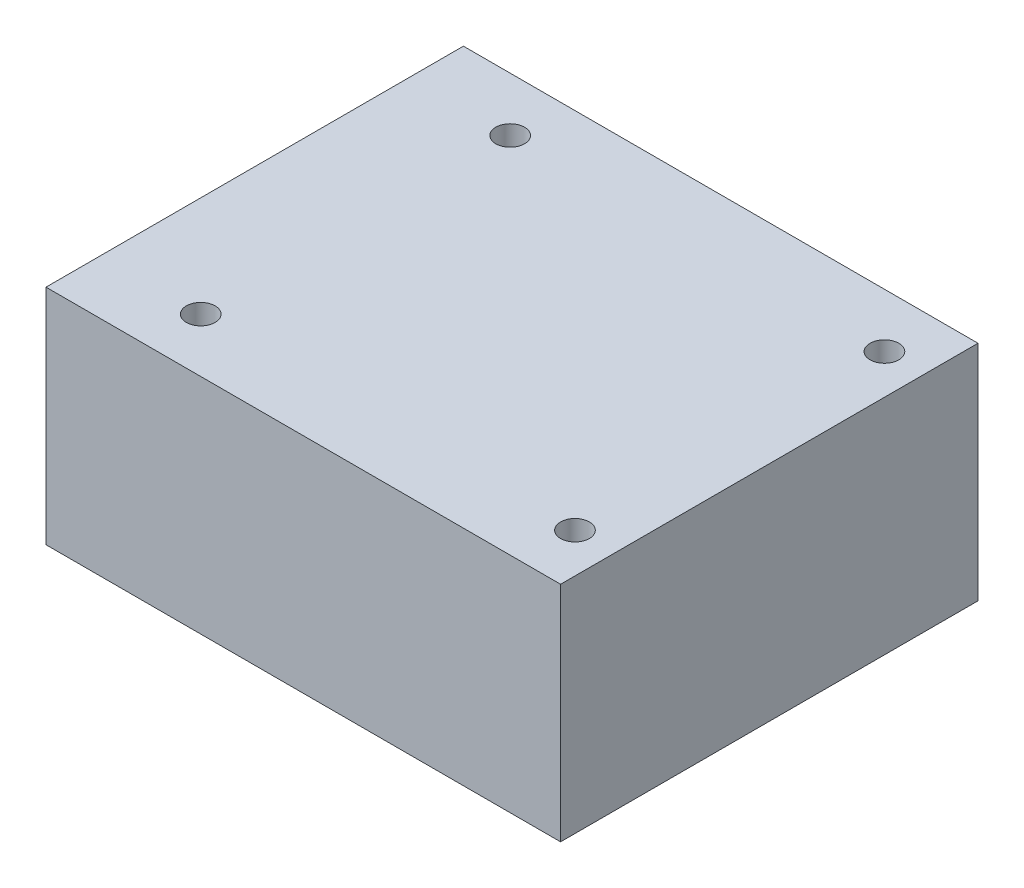
from build123d import *

# Parameters (mm, degrees)
SKETCH_1_W      = 71.5
SKETCH_1_H      = 58
SKETCH_1_R      = 2
EXTRUDE_1_DEPTH = 31


with BuildPart() as part:
    # 草圖1 → 伸長1 (new body)
    with BuildSketch(Plane(origin=(0, 0, 0), x_dir=(1, 0, 0), z_dir=(0, 1, 0))):
        Rectangle(SKETCH_1_W, SKETCH_1_H)
        with Locations(Location((-21.75, 21.5, 0), (0, 0, 270))):
            Circle(SKETCH_1_R, mode=Mode.SUBTRACT)
        with Locations(Location((30.25, 21.5, 0), (0, 0, 270))):
            Circle(SKETCH_1_R, mode=Mode.SUBTRACT)
        with Locations(Location((30.25, -21.5, 0), (0, 0, 270))):
            Circle(SKETCH_1_R, mode=Mode.SUBTRACT)
        with Locations(Location((-21.75, -21.5, 0), (0, 0, 270))):
            Circle(SKETCH_1_R, mode=Mode.SUBTRACT)
    extrude(amount=EXTRUDE_1_DEPTH)


solid = part.part
